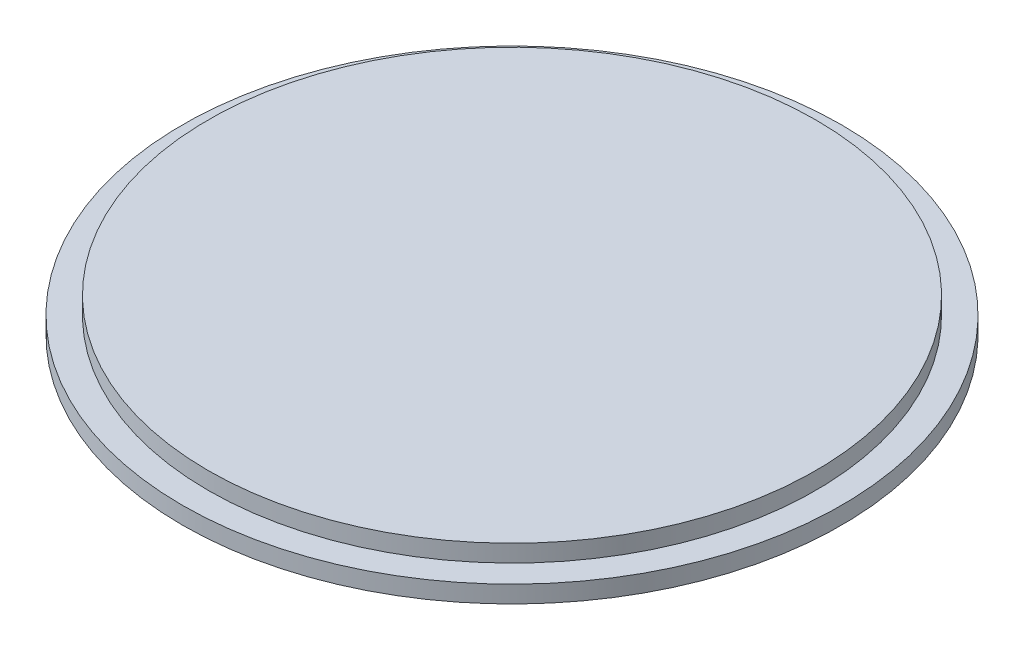
from build123d import *

# Parameters (mm, degrees)
SKETCH2_R           = 57.5
BOSS_EXTRUDE1_DEPTH = 3
SKETCH3_R           = 53
BOSS_EXTRUDE2_DEPTH = 3


with BuildPart() as part:
    # Sketch2 → Boss-Extrude1 (new body)
    with BuildSketch(Plane(origin=(0, 0, 0), x_dir=(1, 0, 0), z_dir=(0, 1, 0))):
        with Locations(Location((0, 0, 0), (0, 0, 270))):
            Circle(SKETCH2_R)
    extrude(amount=BOSS_EXTRUDE1_DEPTH)

    # Sketch3 → Boss-Extrude2 (add)
    with BuildSketch(Plane(origin=(0, 3, 0), x_dir=(1, 0, 0), z_dir=(0, 1, 0))):
        with Locations(Location((0, 0, 0), (0, 0, 270))):
            Circle(SKETCH3_R)
    extrude(amount=BOSS_EXTRUDE2_DEPTH)


solid = part.part
